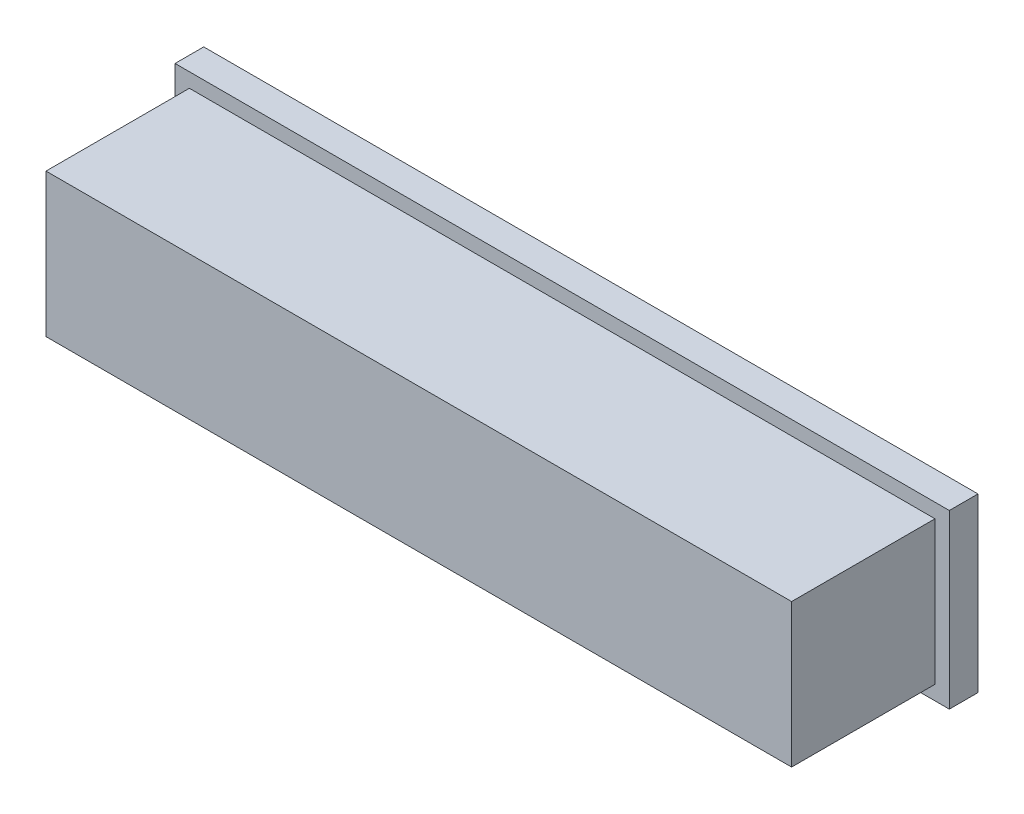
from build123d import *

# Parameters (mm, degrees)
SKIZZE1_W                       = 270
SKIZZE1_H                       = 60
AUFSATZ_LINEAR_AUSTRAGEN1_DEPTH = 10
SKIZZE2_W                       = 260
SKIZZE2_H                       = 50
AUFSATZ_LINEAR_AUSTRAGEN2_DEPTH = 50


with BuildPart() as part:
    # Skizze1 → Aufsatz-Linear austragen1 (new body)
    with BuildSketch(Plane.XY):
        Rectangle(SKIZZE1_W, SKIZZE1_H)
    extrude(amount=AUFSATZ_LINEAR_AUSTRAGEN1_DEPTH)

    # Skizze2 → Aufsatz-Linear austragen2 (add)
    with BuildSketch(Plane.XY.offset(10)):
        Rectangle(SKIZZE2_W, SKIZZE2_H)
    extrude(amount=AUFSATZ_LINEAR_AUSTRAGEN2_DEPTH)


solid = part.part
